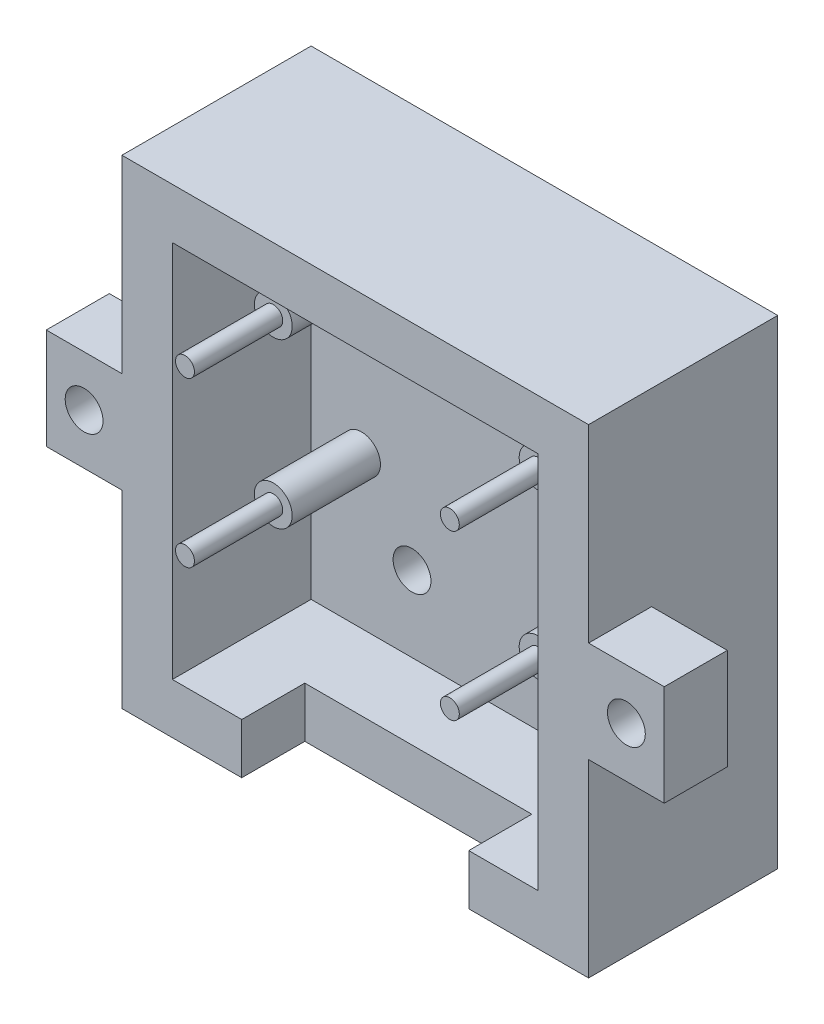
from build123d import *

# Parameters (mm, degrees)
CROQUIS1_W              = 37
CROQUIS1_H              = 38
SALIENTE_EXTRUIR1_DEPTH = 15
VACIADO1_T              = -4
CROQUIS2_W              = 6
CROQUIS2_H              = 8
CROQUIS2_R              = 1.5
SALIENTE_EXTRUIR2_DEPTH = 5
CROQUIS3_W              = 18
CROQUIS3_H              = 5
CORTAR_EXTRUIR1_DEPTH   = 5
CROQUIS4_R              = 1.5
SALIENTE_EXTRUIR3_DEPTH = 7
CROQUIS5_R              = 0.75
SALIENTE_EXTRUIR4_DEPTH = 7
CROQUIS7_R              = 1.5
CORTAR_EXTRUIR2_DEPTH   = 7


with BuildPart() as part:
    # Croquis1 → Saliente-Extruir1 (new body)
    with BuildSketch(Plane.XY):
        Rectangle(CROQUIS1_W, CROQUIS1_H)
    extrude(amount=SALIENTE_EXTRUIR1_DEPTH)

    # Vaciado1
    vaciado1_openings = [part.faces().sort_by_distance(p)[0] for p in [
        (0, 0, 15),
    ]]
    offset(amount=VACIADO1_T, openings=vaciado1_openings, kind=Kind.INTERSECTION)

    # Croquis2 → Saliente-Extruir2 (add)
    with BuildSketch(Plane.XY.offset(15)):
        with Locations((21.5, 0)):
            Rectangle(CROQUIS2_W, CROQUIS2_H)
        with Locations((21.5, 0)):
            Circle(CROQUIS2_R, mode=Mode.SUBTRACT)
    saliente_extruir2 = extrude(amount=-SALIENTE_EXTRUIR2_DEPTH)

    # Simetría1: Saliente-Extruir2 across plane
    add(saliente_extruir2.mirror(Plane(origin=(0, 0, 0), x_dir=(0, 0, 1), z_dir=(1, 0, 0))))

    # Croquis3 → Cortar-Extruir1 (cut)
    with BuildSketch(Plane.XZ.offset(19)):
        with Locations((0, 12.5)):
            Rectangle(CROQUIS3_W, CROQUIS3_H)
    extrude(amount=-CORTAR_EXTRUIR1_DEPTH, mode=Mode.SUBTRACT)

    # Croquis4 → Saliente-Extruir3 (add)
    with BuildSketch(Plane.XY.offset(4)):
        with Locations((-10.5, 10)):
            Circle(CROQUIS4_R)
        with Locations((10.5, 10)):
            Circle(CROQUIS4_R)
        with Locations((10.5, -3)):
            Circle(CROQUIS4_R)
        with Locations((-10.5, -3)):
            Circle(CROQUIS4_R)
    extrude(amount=SALIENTE_EXTRUIR3_DEPTH)

    # Croquis5 → Saliente-Extruir4 (add)
    with BuildSketch(Plane.XY.offset(11)):
        with Locations((-10.5, 10)):
            Circle(CROQUIS5_R)
        with Locations((10.5, 10)):
            Circle(CROQUIS5_R)
        with Locations((10.5, -3)):
            Circle(CROQUIS5_R)
        with Locations((-10.5, -3)):
            Circle(CROQUIS5_R)
    extrude(amount=SALIENTE_EXTRUIR4_DEPTH)

    # Croquis7 → Cortar-Extruir2 (cut)
    with BuildSketch(Plane.XY.offset(4)):
        with Locations((-6.5, 9)):
            Circle(CROQUIS7_R)
        with Locations((6.5, 9)):
            Circle(CROQUIS7_R)
        with Locations((6.5, -9)):
            Circle(CROQUIS7_R)
        with Locations((-6.5, -9)):
            Circle(CROQUIS7_R)
    extrude(amount=-CORTAR_EXTRUIR2_DEPTH, mode=Mode.SUBTRACT)


solid = part.part
